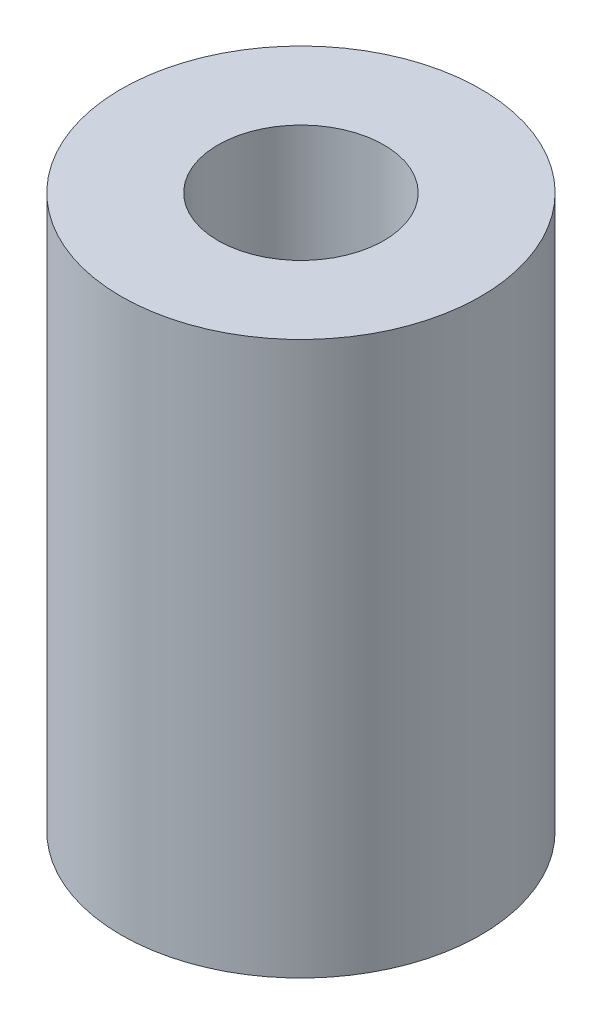
from build123d import *

# Parameters (mm, degrees)
ESQUISSE2_R             = 3.25
BOSS_EXTRU_1_DEPTH      = 10
ESQUISSE1_R             = 1.5
ENL_V_MAT_EXTRU_1_DEPTH = 28


with BuildPart() as part:
    # Esquisse2 → Boss.-Extru.1 (new body)
    with BuildSketch(Plane(origin=(0, 0, 0), x_dir=(1, 0, 0), z_dir=(0, 1, 0))):
        with Locations(Location((0, 0, 0), (0, 0, 270))):
            Circle(ESQUISSE2_R)
    extrude(amount=BOSS_EXTRU_1_DEPTH)

    # Esquisse1 → Enlèv. mat.-Extru.1 (cut)
    with BuildSketch(Plane(origin=(0, 0, 0), x_dir=(1, 0, 0), z_dir=(0, 1, 0))):
        with Locations(Location((0, 0, 0), (0, 0, 270))):
            Circle(ESQUISSE1_R)
    extrude(amount=ENL_V_MAT_EXTRU_1_DEPTH, mode=Mode.SUBTRACT)


solid = part.part
